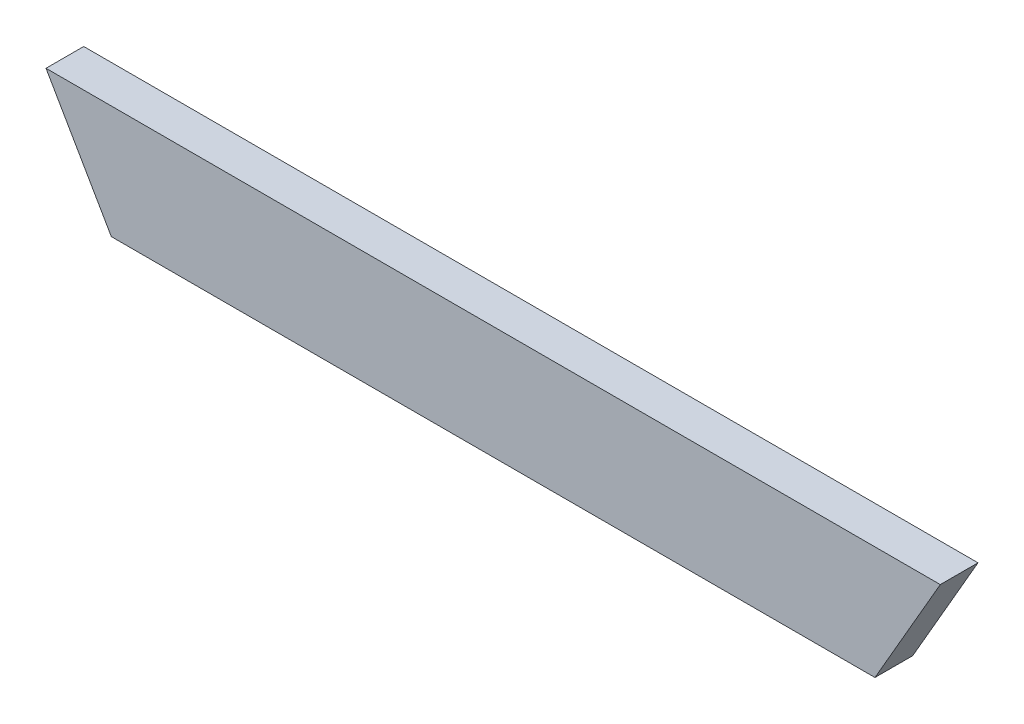
from build123d import *

# Parameters (mm, degrees)
BOSS_EXTRU_1_DEPTH = 15


with BuildPart() as part:
    # Esquisse1 → Boss.-Extru.1 (new body)
    with BuildSketch(Plane.XY):
        Polygon((-225.003085821, 84.109598527), (130.656914179, 84.109598527), (104.676152066, 39.109598527), (-199.022323707, 39.109598527), align=None)
    extrude(amount=BOSS_EXTRU_1_DEPTH)


solid = part.part
